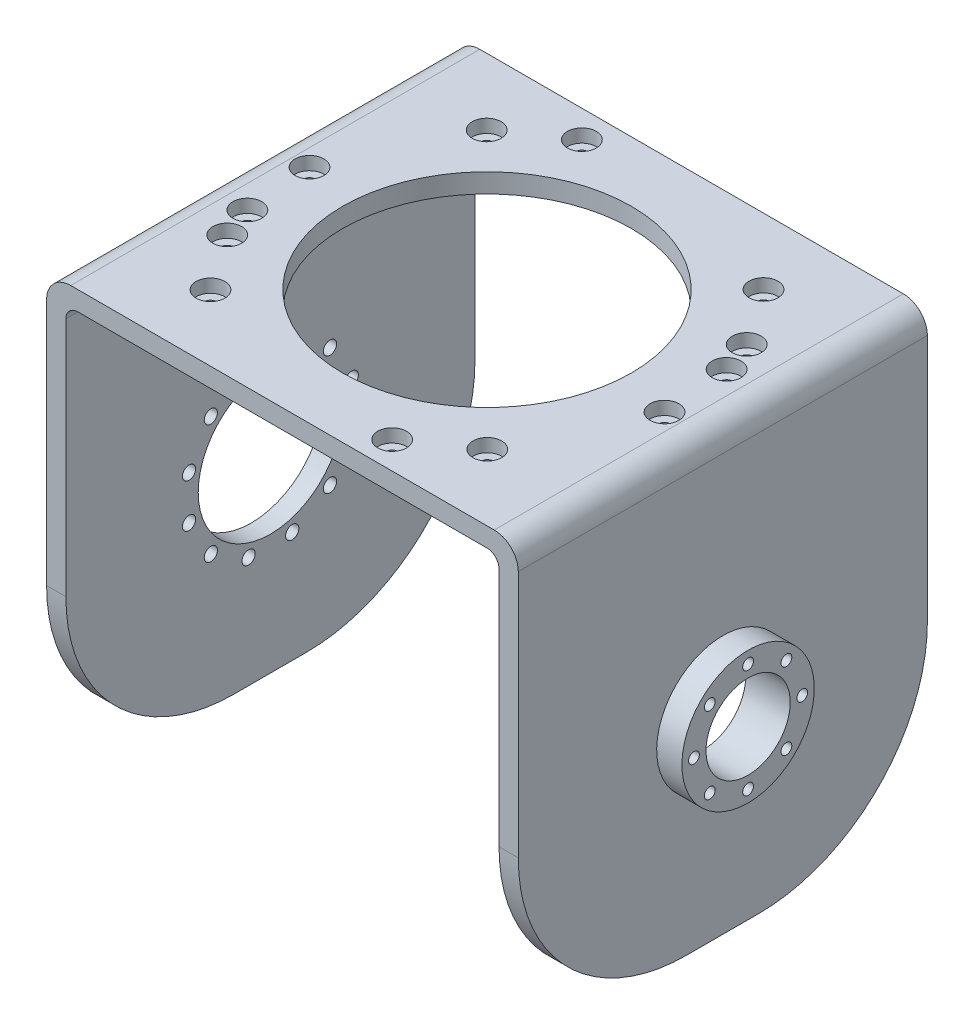
from build123d import *

# Parameters (mm, degrees)
EXTRUDE_1_DEPTH          = 170
SKETCH_2_R               = 60
CUT_EXTRUDE_1_DEPTH      = 180
CUT_EXTRUDE_2_DEPTH      = 313.955268369
CUT_EXTRUDE_2_DEPTH_BACK = 313.955268369
SKETCH_3_R               = 17.5
FILLET_1_R               = 70
FILLET_2_R               = 5
FILLET_3_R               = 10
SKETCH_6_R               = 30
CUT_EXTRUDE_6_DEPTH      = 39
SKETCH_10_R              = 2.5
CUT_EXTRUDE_10_DEPTH     = 10
CUT_EXTRUDE_START        = -5.5
SKETCH_11_R              = 6
SKETCH_11_R_2            = 2.5
CUT_EXTRUDE_11_DEPTH     = 5.5
SKETCH_12_R              = 2.75
CUT_EXTRUDE_12_DEPTH     = 10
EXTRUDE_START            = 10.5
SKETCH_14_R              = 27.5
SKETCH_14_R_2            = 17.5
EXTRUDE_2_DEPTH          = 10.5
SKETCH_13_R              = 2.25
CUT_EXTRUDE_13_DEPTH     = 15


with BuildPart() as part:
    # 草图1 → 凸台-拉伸1 (new body)
    with BuildSketch(Plane.XY):
        Polygon((-180, 0), (0, 0), (0, -175), (8, -175), (8, 8), (-180, 8), (-188, 8), (-188, -175), (-180, -175), align=None)
    extrude(amount=EXTRUDE_1_DEPTH)

    # 草图2 → 切除-拉伸1 (cut)
    with BuildSketch(Plane(origin=(0, 8, 0), x_dir=(1, 0, 0), z_dir=(0, 1, 0))):
        with Locations(Location((-90, -85, 0), (0, 0, 180))):
            Circle(SKETCH_2_R)
    extrude(amount=-CUT_EXTRUDE_1_DEPTH, mode=Mode.SUBTRACT)

    # 草图3 → 切除-拉伸2 (cut, two sides: drawn at the far end of the back side and taken through both)
    with BuildSketch(Plane(origin=(8, 0, 0), x_dir=(0, 0, -1), z_dir=(1, 0, 0)).offset(-CUT_EXTRUDE_2_DEPTH_BACK)):
        with Locations(Location((-85, -95, 0), (0, 0, 90))):
            Circle(SKETCH_3_R)
    extrude(amount=CUT_EXTRUDE_2_DEPTH + CUT_EXTRUDE_2_DEPTH_BACK, mode=Mode.SUBTRACT)

    # 圆角1
    fillet_1_edges = [part.edges().sort_by_distance(p)[0] for p in [
        (4, -175, 0),
        (4, -175, 170),
        (-184, -175, 170),
        (-184, -175, 0),
    ]]
    fillet(fillet_1_edges, radius=FILLET_1_R)

    # 圆角2
    fillet_2_edges = [part.edges().sort_by_distance(p)[0] for p in [
        (0, 0, 85),
        (-180, 0, 85),
    ]]
    fillet(fillet_2_edges, radius=FILLET_2_R)

    # 圆角3
    fillet_3_edges = [part.edges().sort_by_distance(p)[0] for p in [
        (-188, 8, 85),
        (8, 8, 85),
    ]]
    fillet(fillet_3_edges, radius=FILLET_3_R)

    # 草图6 → 切除-拉伸6 (cut)
    with BuildSketch(Plane.ZY.offset(188)):
        with Locations(Location((85, -95, 0), (0, 0, 270))):
            Circle(SKETCH_6_R)
    extrude(amount=-CUT_EXTRUDE_6_DEPTH, mode=Mode.SUBTRACT)

    # 草图10 → 切除-拉伸10 (cut)
    with BuildSketch(Plane.XZ):
        with Locations(Location((-55.742253069, 158.674753309, 0), (0, 0, 270))):
            Circle(SKETCH_10_R)
        with Locations(Location((-32.485217492, 142.390001682, 0), (0, 0, 270))):
            Circle(SKETCH_10_R)
        with Locations(Location((-9.066918551, 92.169297536, 0), (0, 0, 270))):
            Circle(SKETCH_10_R)
        with Locations(Location((-11.541409366, 63.885738097, 0), (0, 0, 270))):
            Circle(SKETCH_10_R)
        with Locations(Location((-16.325246691, 50.742253069, 0), (0, 0, 270))):
            Circle(SKETCH_10_R)
        with Locations(Location((-32.609998318, 27.485217492, 0), (0, 0, 270))):
            Circle(SKETCH_10_R)
        with Locations(Location((-124.257746931, 11.325246691, 0), (0, 0, 270))):
            Circle(SKETCH_10_R)
        with Locations(Location((-147.514782508, 27.609998318, 0), (0, 0, 270))):
            Circle(SKETCH_10_R)
        with Locations(Location((-170.933081449, 77.830702464, 0), (0, 0, 270))):
            Circle(SKETCH_10_R)
        with Locations(Location((-168.458590634, 106.114261903, 0), (0, 0, 270))):
            Circle(SKETCH_10_R)
        with Locations(Location((-163.674753309, 119.257746931, 0), (0, 0, 270))):
            Circle(SKETCH_10_R)
        with Locations(Location((-147.390001682, 142.514782508, 0), (0, 0, 270))):
            Circle(SKETCH_10_R)
    extrude(amount=-CUT_EXTRUDE_10_DEPTH, mode=Mode.SUBTRACT)

    # 草图11 → 切除-拉伸11 (cut)
    # profile 1 of 12: a face of its own
    with BuildSketch(Plane(origin=(0, 8, 0), x_dir=(1, 0, 0), z_dir=(0, 1, 0)).offset(CUT_EXTRUDE_START)):
        with Locations(Location((-32.485217492, -142.390001682, 0), (0, 0, 180))):
            Circle(SKETCH_11_R)
        with Locations(Location((-32.485217492, -142.390001682, 0), (0, 0, 90))):
            Circle(SKETCH_11_R_2, mode=Mode.SUBTRACT)
    # profile 2 of 12: a face of its own
    with BuildSketch(Plane(origin=(0, 8, 0), x_dir=(1, 0, 0), z_dir=(0, 1, 0)).offset(CUT_EXTRUDE_START)):
        with Locations(Location((-55.742253069, -158.674753309, 0), (0, 0, 180))):
            Circle(SKETCH_11_R)
        with Locations(Location((-55.742253069, -158.674753309, 0), (0, 0, 90))):
            Circle(SKETCH_11_R_2, mode=Mode.SUBTRACT)
    # profile 3 of 12: a face of its own
    with BuildSketch(Plane(origin=(0, 8, 0), x_dir=(1, 0, 0), z_dir=(0, 1, 0)).offset(CUT_EXTRUDE_START)):
        with Locations(Location((-147.390001682, -142.514782508, 0), (0, 0, 180))):
            Circle(SKETCH_11_R)
        with Locations(Location((-147.390001682, -142.514782508, 0), (0, 0, 90))):
            Circle(SKETCH_11_R_2, mode=Mode.SUBTRACT)
    # profile 4 of 12: a face of its own
    with BuildSketch(Plane(origin=(0, 8, 0), x_dir=(1, 0, 0), z_dir=(0, 1, 0)).offset(CUT_EXTRUDE_START)):
        with Locations(Location((-163.674753309, -119.257746931, 0), (0, 0, 180))):
            Circle(SKETCH_11_R)
        with Locations(Location((-163.674753309, -119.257746931, 0), (0, 0, 90))):
            Circle(SKETCH_11_R_2, mode=Mode.SUBTRACT)
    # profile 5 of 12: a face of its own
    with BuildSketch(Plane(origin=(0, 8, 0), x_dir=(1, 0, 0), z_dir=(0, 1, 0)).offset(CUT_EXTRUDE_START)):
        with Locations(Location((-168.458590634, -106.114261903, 0), (0, 0, 180))):
            Circle(SKETCH_11_R)
        with Locations(Location((-168.458590634, -106.114261903, 0), (0, 0, 90))):
            Circle(SKETCH_11_R_2, mode=Mode.SUBTRACT)
    # profile 6 of 12: a face of its own
    with BuildSketch(Plane(origin=(0, 8, 0), x_dir=(1, 0, 0), z_dir=(0, 1, 0)).offset(CUT_EXTRUDE_START)):
        with Locations(Location((-170.933081449, -77.830702464, 0), (0, 0, 180))):
            Circle(SKETCH_11_R)
        with Locations(Location((-170.933081449, -77.830702464, 0), (0, 0, 90))):
            Circle(SKETCH_11_R_2, mode=Mode.SUBTRACT)
    # profile 7 of 12: a face of its own
    with BuildSketch(Plane(origin=(0, 8, 0), x_dir=(1, 0, 0), z_dir=(0, 1, 0)).offset(CUT_EXTRUDE_START)):
        with Locations(Location((-147.514782508, -27.609998318, 0), (0, 0, 180))):
            Circle(SKETCH_11_R)
        with Locations(Location((-147.514782508, -27.609998318, 0), (0, 0, 90))):
            Circle(SKETCH_11_R_2, mode=Mode.SUBTRACT)
    # profile 8 of 12: a face of its own
    with BuildSketch(Plane(origin=(0, 8, 0), x_dir=(1, 0, 0), z_dir=(0, 1, 0)).offset(CUT_EXTRUDE_START)):
        with Locations(Location((-124.257746931, -11.325246691, 0), (0, 0, 180))):
            Circle(SKETCH_11_R)
        with Locations(Location((-124.257746931, -11.325246691, 0), (0, 0, 90))):
            Circle(SKETCH_11_R_2, mode=Mode.SUBTRACT)
    # profile 9 of 12: a face of its own
    with BuildSketch(Plane(origin=(0, 8, 0), x_dir=(1, 0, 0), z_dir=(0, 1, 0)).offset(CUT_EXTRUDE_START)):
        with Locations(Location((-32.609998318, -27.485217492, 0), (0, 0, 180))):
            Circle(SKETCH_11_R)
        with Locations(Location((-32.609998318, -27.485217492, 0), (0, 0, 90))):
            Circle(SKETCH_11_R_2, mode=Mode.SUBTRACT)
    # profile 10 of 12: a face of its own
    with BuildSketch(Plane(origin=(0, 8, 0), x_dir=(1, 0, 0), z_dir=(0, 1, 0)).offset(CUT_EXTRUDE_START)):
        with Locations(Location((-16.325246691, -50.742253069, 0), (0, 0, 180))):
            Circle(SKETCH_11_R)
        with Locations(Location((-16.325246691, -50.742253069, 0), (0, 0, 90))):
            Circle(SKETCH_11_R_2, mode=Mode.SUBTRACT)
    # profile 11 of 12: a face of its own
    with BuildSketch(Plane(origin=(0, 8, 0), x_dir=(1, 0, 0), z_dir=(0, 1, 0)).offset(CUT_EXTRUDE_START)):
        with Locations(Location((-11.541409366, -63.885738097, 0), (0, 0, 180))):
            Circle(SKETCH_11_R)
        with Locations(Location((-11.541409366, -63.885738097, 0), (0, 0, 90))):
            Circle(SKETCH_11_R_2, mode=Mode.SUBTRACT)
    # profile 12 of 12: a face of its own
    with BuildSketch(Plane(origin=(0, 8, 0), x_dir=(1, 0, 0), z_dir=(0, 1, 0)).offset(CUT_EXTRUDE_START)):
        with Locations(Location((-9.066918551, -92.169297536, 0), (0, 0, 180))):
            Circle(SKETCH_11_R)
        with Locations(Location((-9.066918551, -92.169297536, 0), (0, 0, 90))):
            Circle(SKETCH_11_R_2, mode=Mode.SUBTRACT)
    extrude(amount=CUT_EXTRUDE_11_DEPTH, mode=Mode.SUBTRACT)

    # 草图12 → 切除-拉伸12 (cut)
    with BuildSketch(Plane.ZY.offset(188)):
        with Locations(Location((94.058666579, -128.80740392, 0), (0, 0, 270))):
            Circle(SKETCH_12_R)
        with Locations(Location((75.941333421, -128.80740392, 0), (0, 0, 270))):
            Circle(SKETCH_12_R)
        with Locations(Location((60.251262658, -119.748737342, 0), (0, 0, 270))):
            Circle(SKETCH_12_R)
        with Locations(Location((51.19259608, -104.058666579, 0), (0, 0, 270))):
            Circle(SKETCH_12_R)
        with Locations(Location((51.19259608, -85.941333421, 0), (0, 0, 270))):
            Circle(SKETCH_12_R)
        with Locations(Location((60.251262658, -70.251262658, 0), (0, 0, 270))):
            Circle(SKETCH_12_R)
        with Locations(Location((75.941333421, -61.19259608, 0), (0, 0, 270))):
            Circle(SKETCH_12_R)
        with Locations(Location((94.058666579, -61.19259608, 0), (0, 0, 270))):
            Circle(SKETCH_12_R)
        with Locations(Location((109.748737342, -70.251262658, 0), (0, 0, 270))):
            Circle(SKETCH_12_R)
        with Locations(Location((118.80740392, -85.941333421, 0), (0, 0, 270))):
            Circle(SKETCH_12_R)
        with Locations(Location((118.80740392, -104.058666579, 0), (0, 0, 270))):
            Circle(SKETCH_12_R)
        with Locations(Location((109.748737342, -119.748737342, 0), (0, 0, 270))):
            Circle(SKETCH_12_R)
    extrude(amount=-CUT_EXTRUDE_12_DEPTH, mode=Mode.SUBTRACT)

    # 草图14 → 凸台-拉伸2 (add)
    with BuildSketch(Plane(origin=(8, 0, 0), x_dir=(0, 0, -1), z_dir=(1, 0, 0)).offset(EXTRUDE_START)):
        with Locations(Location((-85, -95, 0), (0, 0, 270))):
            Circle(SKETCH_14_R)
        with Locations(Location((-85, -95, 0), (0, 0, 90))):
            Circle(SKETCH_14_R_2, mode=Mode.SUBTRACT)
    extrude(amount=-EXTRUDE_2_DEPTH)

    # 草图13 → 切除-拉伸13 (cut, symmetric)
    with BuildSketch(Plane(origin=(8, 0, 0), x_dir=(0, 0, -1), z_dir=(1, 0, 0))):
        with Locations(Location((-85, -72.5, 0), (0, 0, 90))):
            Circle(SKETCH_13_R)
        with Locations(Location((-69.090097423, -79.090097423, 0), (0, 0, 90))):
            Circle(SKETCH_13_R)
        with Locations(Location((-62.5, -95, 0), (0, 0, 90))):
            Circle(SKETCH_13_R)
        with Locations(Location((-69.090097423, -110.909902577, 0), (0, 0, 90))):
            Circle(SKETCH_13_R)
        with Locations(Location((-85, -117.5, 0), (0, 0, 90))):
            Circle(SKETCH_13_R)
        with Locations(Location((-100.909902577, -110.909902577, 0), (0, 0, 90))):
            Circle(SKETCH_13_R)
        with Locations(Location((-107.5, -95, 0), (0, 0, 90))):
            Circle(SKETCH_13_R)
        with Locations(Location((-100.909902577, -79.090097423, 0), (0, 0, 90))):
            Circle(SKETCH_13_R)
    extrude(amount=CUT_EXTRUDE_13_DEPTH, both=True, mode=Mode.SUBTRACT)


solid = part.part
